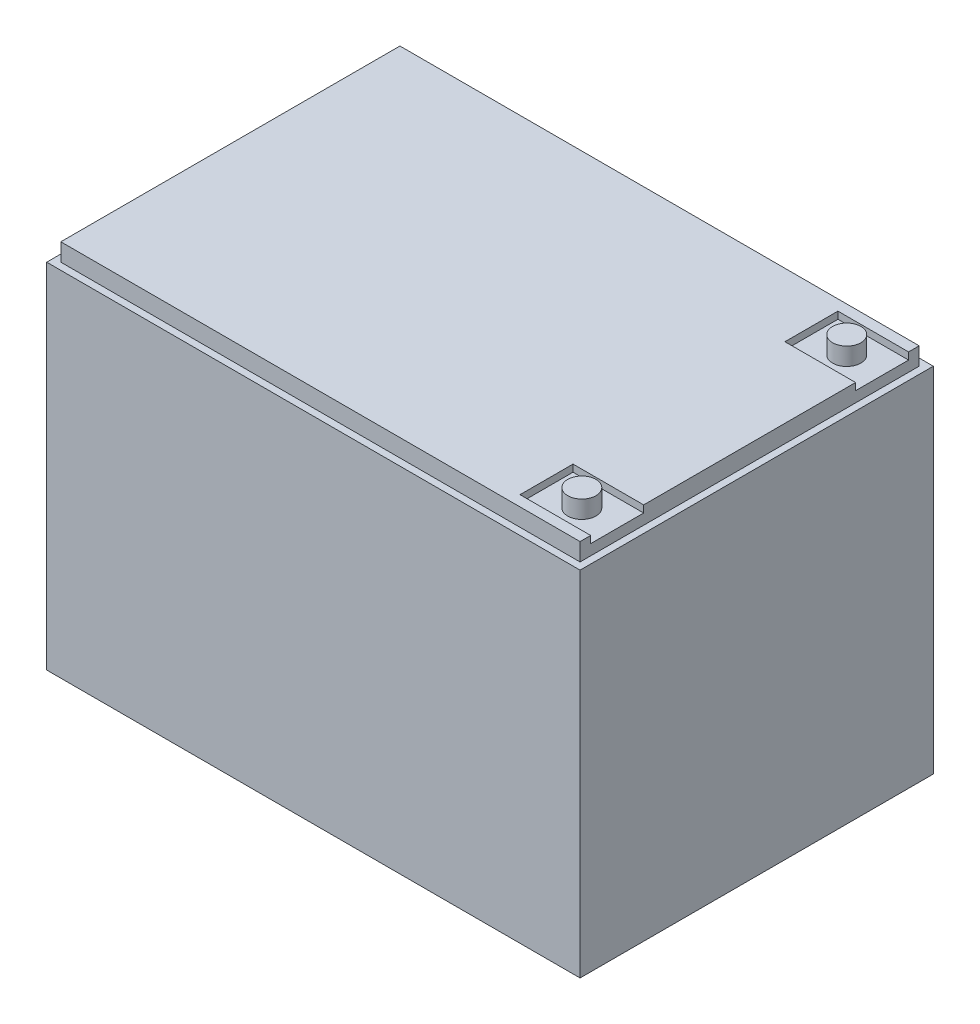
from build123d import *

# Parameters (mm, degrees)
SKETCH1_W           = 151
SKETCH1_H           = 100
BOSS_EXTRUDE1_DEPTH = 105
SKETCH2_W           = 151
SKETCH2_H           = 100
SKETCH2_W_2         = 147
SKETCH2_H_2         = 96
CUT_EXTRUDE1_DEPTH  = 5
SKETCH3_W           = 20
SKETCH3_H           = 15
CUT_EXTRUDE2_DEPTH  = 2
SKETCH4_R           = 4
BOSS_EXTRUDE2_DEPTH = 5


with BuildPart() as part:
    # Sketch1 → Boss-Extrude1 (new body)
    with BuildSketch(Plane(origin=(0, 0, 0), x_dir=(1, 0, 0), z_dir=(0, 1, 0))):
        Rectangle(SKETCH1_W, SKETCH1_H)
    extrude(amount=BOSS_EXTRUDE1_DEPTH)

    # Sketch2 → Cut-Extrude1 (cut)
    with BuildSketch(Plane(origin=(0, 105, 0), x_dir=(1, 0, 0), z_dir=(0, 1, 0))):
        Rectangle(SKETCH2_W, SKETCH2_H)
        Rectangle(SKETCH2_W_2, SKETCH2_H_2, mode=Mode.SUBTRACT)
    extrude(amount=-CUT_EXTRUDE1_DEPTH, mode=Mode.SUBTRACT)

    # Sketch3 → Cut-Extrude2 (cut)
    with BuildSketch(Plane(origin=(0, 105, 0), x_dir=(1, 0, 0), z_dir=(0, 1, 0))):
        with Locations((63.5, 37.5)):
            Rectangle(SKETCH3_W, SKETCH3_H)
        with Locations((63.5, -37.5)):
            Rectangle(SKETCH3_W, SKETCH3_H)
    extrude(amount=-CUT_EXTRUDE2_DEPTH, mode=Mode.SUBTRACT)

    # Sketch4 → Boss-Extrude2 (add)
    with BuildSketch(Plane(origin=(0, 103, 0), x_dir=(1, 0, 0), z_dir=(0, 1, 0))):
        with Locations(Location((63.5, -37.5, 0), (0, 0, 270))):
            Circle(SKETCH4_R)
        with Locations(Location((63.5, 37.5, 0), (0, 0, 90))):
            Circle(SKETCH4_R)
    extrude(amount=BOSS_EXTRUDE2_DEPTH)


solid = part.part
